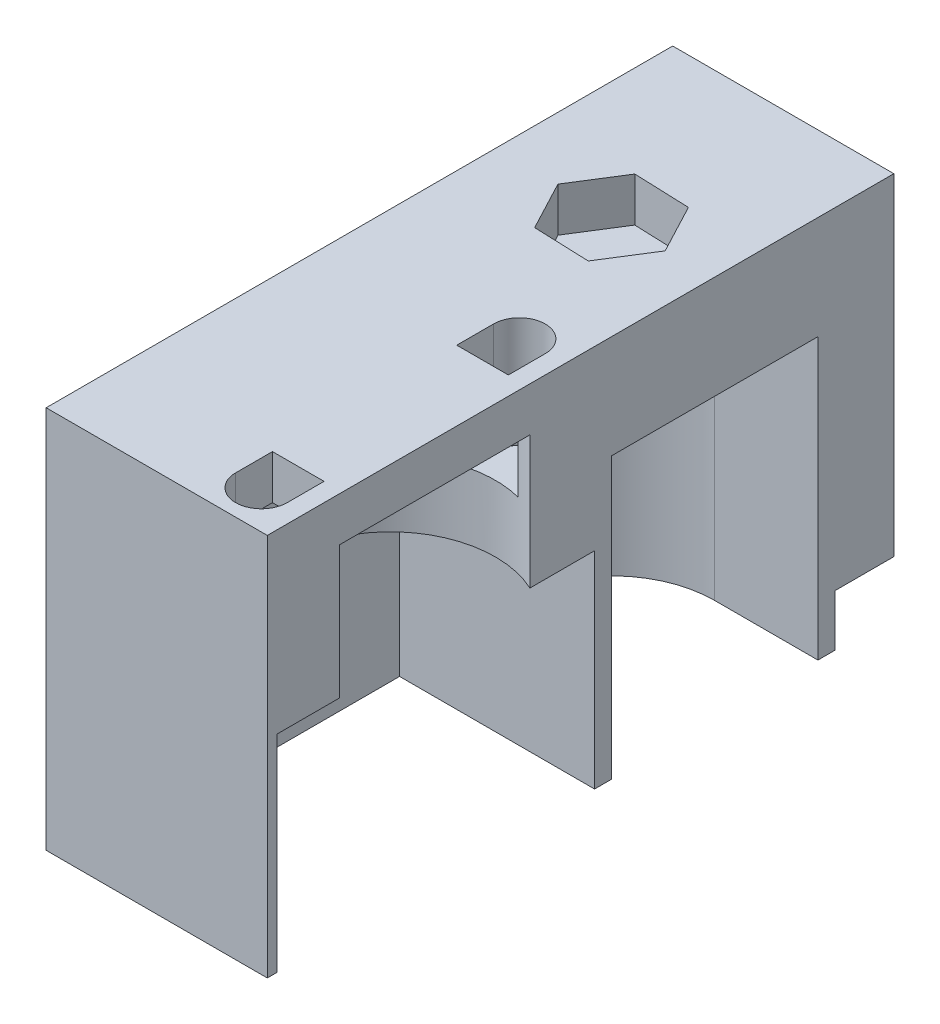
from build123d import *

# Parameters (mm, degrees)
SKETCH1_W           = 30
SKETCH1_H           = 52
BOSS_EXTRUDE1_DEPTH = 85
SKETCH2_R           = 14.25
CUT_EXTRUDE1_DEPTH  = 51
SKETCH3_R           = 11.218089099
CUT_EXTRUDE2_DEPTH  = 27
CUT_EXTRUDE3_DEPTH  = 6
CUT_EXTRUDE4_DEPTH  = 15
SKETCH4_W           = 26.454461606
SKETCH4_H           = 43.1
CUT_EXTRUDE5_DEPTH  = 28
CUT_EXTRUDE6_DEPTH  = 46
SKETCH8_W           = 25
SKETCH8_H           = 7
CUT_EXTRUDE7_DEPTH  = 8


with BuildPart() as part:
    # Sketch1 → Boss-Extrude1 (new body)
    with BuildSketch(Plane.XY):
        with Locations((-485, 30)):
            Rectangle(SKETCH1_W, SKETCH1_H)
    extrude(amount=BOSS_EXTRUDE1_DEPTH)

    # Sketch2 → Cut-Extrude1 (cut)
    with BuildSketch(Plane(origin=(0, 50, 0), x_dir=(1, 0, 0), z_dir=(0, 1, 0))):
        with Locations((-475.99810076, -62.3)):
            Circle(SKETCH2_R)
    extrude(amount=-CUT_EXTRUDE1_DEPTH, mode=Mode.SUBTRACT)

    # Sketch3 → Cut-Extrude2 (cut)
    with BuildSketch(Plane.XZ.offset(-4)):
        with Locations((-483.99810076, 62.3)):
            Circle(SKETCH3_R)
    extrude(amount=-CUT_EXTRUDE2_DEPTH, mode=Mode.SUBTRACT)

    # Sketch5 → Cut-Extrude3 (cut)
    with BuildSketch(Plane(origin=(0, 56, 0), x_dir=(1, 0, 0), z_dir=(0, 1, 0))):
        Polygon((-488.026219091, -30.701179091), (-480.468321914, -30.986702473), (-476.442102823, -24.584133211), (-479.973780909, -17.896040565), (-487.531678086, -17.610517183), (-491.557897177, -24.013086446), align=None)
    extrude(amount=-CUT_EXTRUDE3_DEPTH, mode=Mode.SUBTRACT)

    # Sketch6 → Cut-Extrude4 (cut)
    with BuildSketch(Plane(origin=(0, 56, 0), x_dir=(1, 0, 0), z_dir=(0, 1, 0))):
        with BuildLine():
            Line((-472.49810076, -79.8), (-472.49810076, -74.8))
            Line((-472.49810076, -74.8), (-479.49810076, -74.8))
            Line((-479.49810076, -74.8), (-479.49810076, -79.8))
            ThreePointArc((-479.49810076, -79.8), (-475.99810076, -83.3), (-472.49810076, -79.8))
        make_face()
        with BuildLine():
            Line((-472.49810076, -44.8), (-472.49810076, -49.8))
            Line((-472.49810076, -49.8), (-479.49810076, -49.8))
            Line((-479.49810076, -49.8), (-479.49810076, -44.8))
            ThreePointArc((-479.49810076, -44.8), (-475.99810076, -41.3), (-472.49810076, -44.8))
        make_face()
    extrude(amount=-CUT_EXTRUDE4_DEPTH, mode=Mode.SUBTRACT)

    # Sketch4 → Cut-Extrude5 (cut)
    with BuildSketch(Plane(origin=(0, 4, 0), x_dir=(-1, 0, 0), z_dir=(0, -1, 0))):
        with Locations((483.227230803, -62.15)):
            Rectangle(SKETCH4_W, SKETCH4_H)
    extrude(amount=-CUT_EXTRUDE5_DEPTH, mode=Mode.SUBTRACT)

    # Sketch7 → Cut-Extrude6 (cut)
    with BuildSketch(Plane(origin=(0, 42, 0), x_dir=(1, 0, 0), z_dir=(0, 1, 0))):
        with BuildLine():
            Line((-484, -10.298609828), (-469.568981223, -10.298609828))
            Line((-469.568981223, -10.298609828), (-469.568981223, -38.298609828))
            Line((-469.568981223, -38.298609828), (-484, -38.298609828))
            ThreePointArc((-484, -38.298609828), (-498, -24.298609828), (-484, -10.298609828))
        make_face()
    extrude(amount=-CUT_EXTRUDE6_DEPTH, mode=Mode.SUBTRACT)

    # Sketch8 → Cut-Extrude7 (cut)
    with BuildSketch(Plane(origin=(0, 0, 0), x_dir=(-1, 0, 0), z_dir=(0, 0, -1))):
        with Locations((482.5, 7.5)):
            Rectangle(SKETCH8_W, SKETCH8_H)
    extrude(amount=-CUT_EXTRUDE7_DEPTH, mode=Mode.SUBTRACT)


solid = part.part
